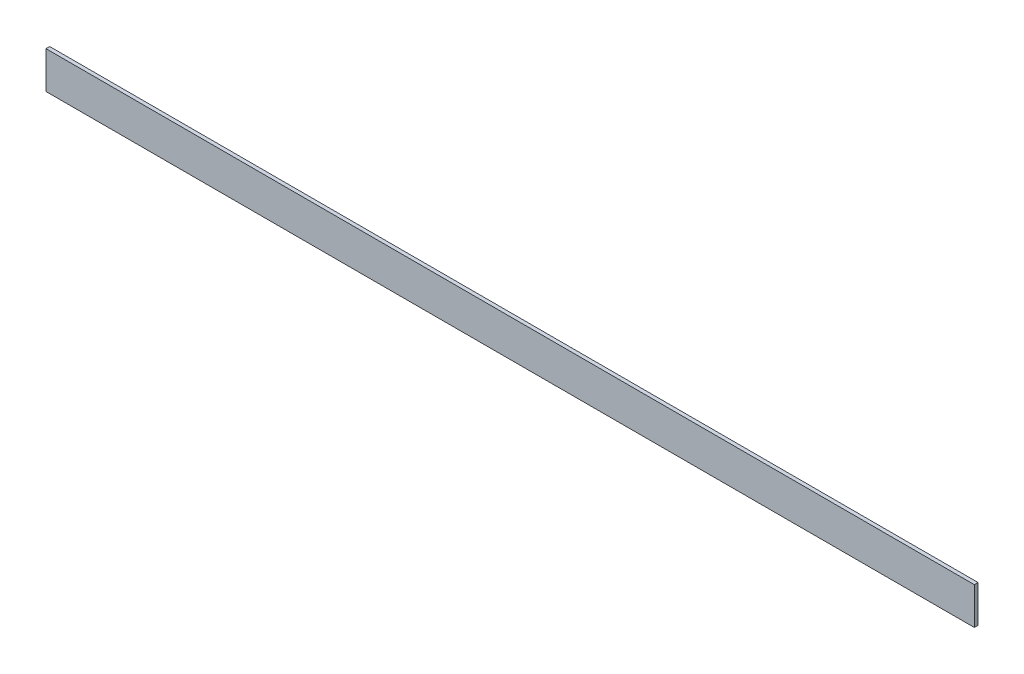
from build123d import *

# Parameters (mm, degrees)
SKETCH1_W     = 125
SKETCH1_H     = 5
PROFILE_DEPTH = 0.5


with BuildPart() as part:
    # Sketch1 → Profile (new body)
    with BuildSketch(Plane.XY):
        with Locations((62.5, 2.5)):
            Rectangle(SKETCH1_W, SKETCH1_H)
    extrude(amount=PROFILE_DEPTH)


solid = part.part
